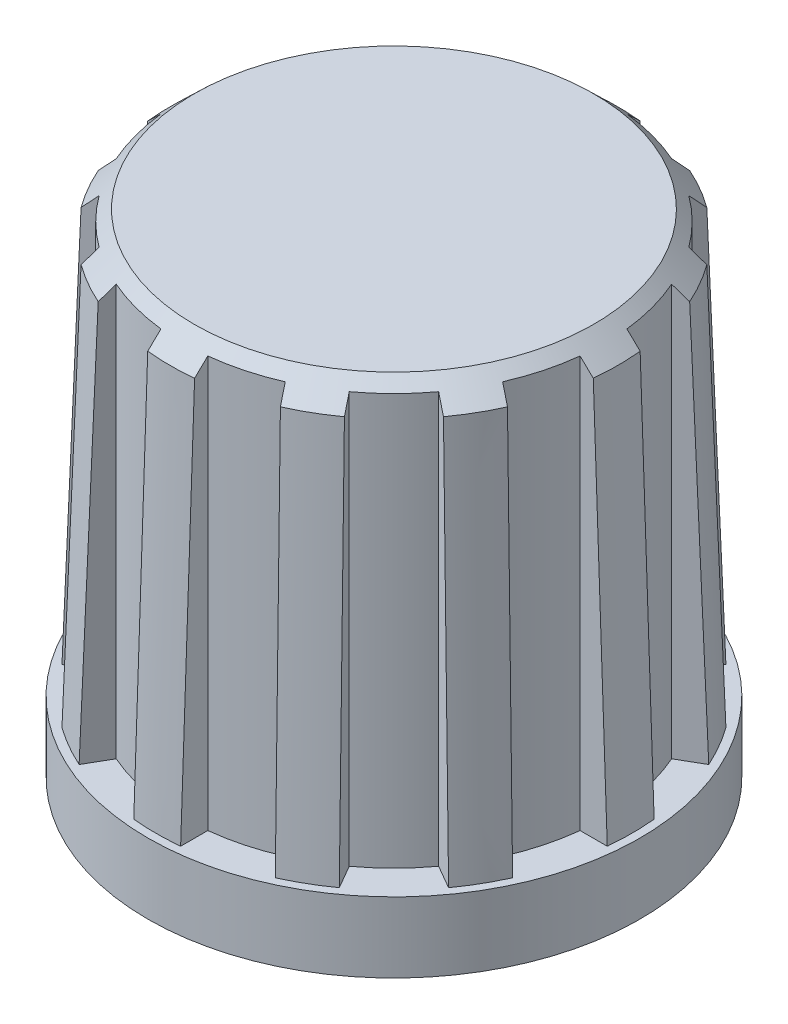
from build123d import *

# Parameters (mm, degrees)
CUT_EXTRUDE_START   = -30
SKETCH_2_R          = 23.333333333
CUT_EXTRUDE_1_DEPTH = 30
CUT_EXTRUDE_2_DEPTH = 5


with BuildPart() as part:
    # 草图1 → 旋转1 (revolve)
    with BuildSketch(Plane.XY):
        Polygon((0, 35), (14.208787172, 35), (15.933619666, 33.334348622), (16.923076923, 5), (17.5, 5), (17.5, 0), (8, 0), (6.9175, 1.0825), (6.9175, 23.5), (0, 23.5), align=None)
    revolve(axis=Axis((0, 0, 0), (0, 1, 0)))

    # 草图2 → 切除-拉伸1 (cut)
    with BuildSketch(Plane(origin=(0, 35, 0), x_dir=(1, 0, 0), z_dir=(0, 1, 0)).offset(CUT_EXTRUDE_START)):
        Circle(SKETCH_2_R)
        with BuildLine():
            Line((-17.420454134, -1.666666667), (-14.90711985, -1.666666667))
            ThreePointArc((-14.90711985, -1.666666667), (-14.488887394, -3.882285677), (-13.743277821, -6.010184252))
            Line((-13.743277821, -6.010184252), (-15.919889159, -7.266851394))
            ThreePointArc((-15.919889159, -7.266851394), (-15.155444566, -8.75), (-14.253222492, -10.15360274))
            Line((-14.253222492, -10.15360274), (-12.076611154, -8.896935598))
            ThreePointArc((-12.076611154, -8.896935598), (-10.606601718, -10.606601718), (-8.896935598, -12.076611154))
            Line((-8.896935598, -12.076611154), (-10.15360274, -14.253222492))
            ThreePointArc((-10.15360274, -14.253222492), (-8.75, -15.155444566), (-7.266851394, -15.919889159))
            Line((-7.266851394, -15.919889159), (-6.010184252, -13.743277821))
            ThreePointArc((-6.010184252, -13.743277821), (-3.882285677, -14.488887394), (-1.666666667, -14.90711985))
            Line((-1.666666667, -14.90711985), (-1.666666667, -17.420454134))
            ThreePointArc((-1.666666667, -17.420454134), (0, -17.5), (1.666666667, -17.420454134))
            Line((1.666666667, -17.420454134), (1.666666667, -14.90711985))
            ThreePointArc((1.666666667, -14.90711985), (3.882285677, -14.488887394), (6.010184252, -13.743277821))
            Line((6.010184252, -13.743277821), (7.266851394, -15.919889159))
            ThreePointArc((7.266851394, -15.919889159), (8.75, -15.155444566), (10.15360274, -14.253222492))
            Line((10.15360274, -14.253222492), (8.896935598, -12.076611154))
            ThreePointArc((8.896935598, -12.076611154), (10.606601718, -10.606601718), (12.076611154, -8.896935598))
            Line((12.076611154, -8.896935598), (14.253222492, -10.15360274))
            ThreePointArc((14.253222492, -10.15360274), (15.155444566, -8.75), (15.919889159, -7.266851394))
            Line((15.919889159, -7.266851394), (13.743277821, -6.010184252))
            ThreePointArc((13.743277821, -6.010184252), (14.488887394, -3.882285677), (14.90711985, -1.666666667))
            Line((14.90711985, -1.666666667), (17.420454134, -1.666666667))
            ThreePointArc((17.420454134, -1.666666667), (17.5, 0), (17.420454134, 1.666666667))
            Line((17.420454134, 1.666666667), (14.90711985, 1.666666667))
            ThreePointArc((14.90711985, 1.666666667), (14.488887394, 3.882285677), (13.743277821, 6.010184252))
            Line((13.743277821, 6.010184252), (15.919889159, 7.266851394))
            ThreePointArc((15.919889159, 7.266851394), (15.155444566, 8.75), (14.253222492, 10.15360274))
            Line((14.253222492, 10.15360274), (12.076611154, 8.896935598))
            ThreePointArc((12.076611154, 8.896935598), (10.606601718, 10.606601718), (8.896935598, 12.076611154))
            Line((8.896935598, 12.076611154), (10.15360274, 14.253222492))
            ThreePointArc((10.15360274, 14.253222492), (8.75, 15.155444566), (7.266851394, 15.919889159))
            Line((7.266851394, 15.919889159), (6.010184252, 13.743277821))
            ThreePointArc((6.010184252, 13.743277821), (3.882285677, 14.488887394), (1.666666667, 14.90711985))
            Line((1.666666667, 14.90711985), (1.666666667, 17.420454134))
            ThreePointArc((1.666666667, 17.420454134), (0, 17.5), (-1.666666667, 17.420454134))
            Line((-1.666666667, 17.420454134), (-1.666666667, 14.90711985))
            ThreePointArc((-1.666666667, 14.90711985), (-3.882285677, 14.488887394), (-6.010184252, 13.743277821))
            Line((-6.010184252, 13.743277821), (-7.266851394, 15.919889159))
            ThreePointArc((-7.266851394, 15.919889159), (-8.75, 15.155444566), (-10.15360274, 14.253222492))
            Line((-10.15360274, 14.253222492), (-8.896935598, 12.076611154))
            ThreePointArc((-8.896935598, 12.076611154), (-10.606601718, 10.606601718), (-12.076611154, 8.896935598))
            Line((-12.076611154, 8.896935598), (-14.253222492, 10.15360274))
            ThreePointArc((-14.253222492, 10.15360274), (-15.155444566, 8.75), (-15.919889159, 7.266851394))
            Line((-15.919889159, 7.266851394), (-13.743277821, 6.010184252))
            ThreePointArc((-13.743277821, 6.010184252), (-14.488887394, 3.882285677), (-14.90711985, 1.666666667))
            Line((-14.90711985, 1.666666667), (-17.420454134, 1.666666667))
            ThreePointArc((-17.420454134, 1.666666667), (-17.5, 0), (-17.420454134, -1.666666667))
        make_face(mode=Mode.SUBTRACT)
    extrude(amount=CUT_EXTRUDE_1_DEPTH, mode=Mode.SUBTRACT)

    # 草图3 → 切除-拉伸2 (cut)
    with BuildSketch(Plane(origin=(0, 23.5, 0), x_dir=(1, 0, 0), z_dir=(0, 1, 0))):
        with BuildLine():
            Line((1.538461538, -2.757795363), (1.538461538, 2.757795363))
            ThreePointArc((1.538461538, 2.757795363), (0, 3.157894737), (-1.538461538, 2.757795363))
            Line((-1.538461538, 2.757795363), (-1.538461538, -2.757795363))
            ThreePointArc((-1.538461538, -2.757795363), (0, -3.157894737), (1.538461538, -2.757795363))
        make_face()
    extrude(amount=CUT_EXTRUDE_2_DEPTH, mode=Mode.SUBTRACT)


solid = part.part
